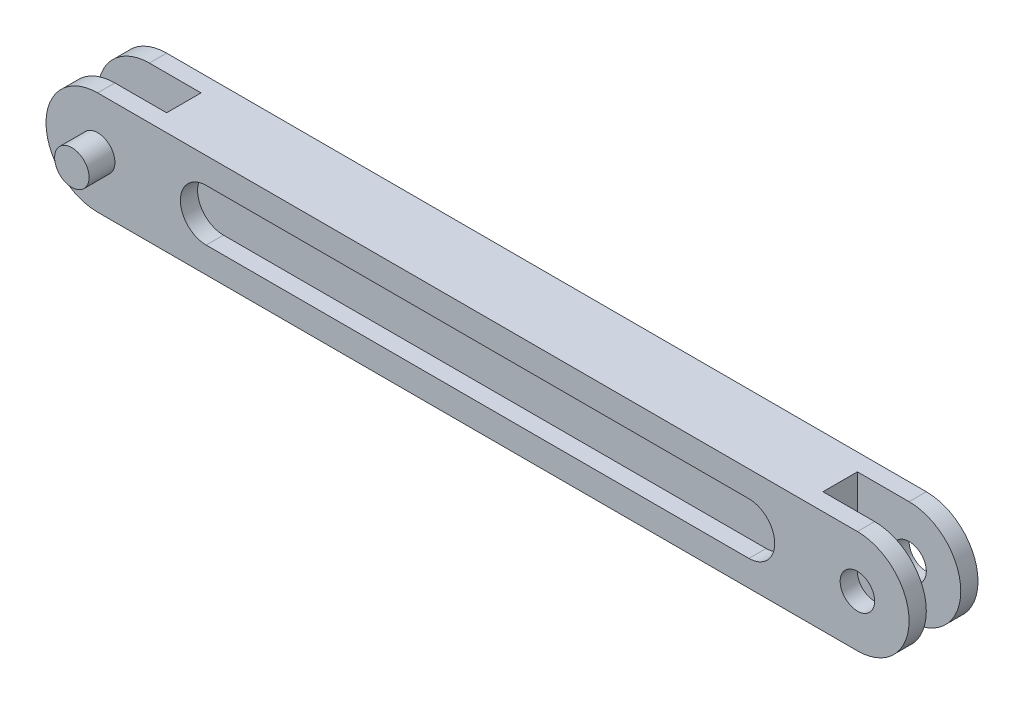
from build123d import *

# Parameters (mm, degrees)
SKETCH1_R                = 6.35
BOSS_EXTRUDE1_DEPTH      = 25.4
CUT_EXTRUDE1_DEPTH       = 6.35
SKETCH3_W                = 12.7
SKETCH3_H                = 38.1
CUT_EXTRUDE2_DEPTH       = 38.1
BOSS_EXTRUDE3_DEPTH      = 9.525
BOSS_EXTRUDE3_DEPTH_BACK = 34.925
SKETCH5_R                = 6.35


with BuildPart() as part:
    # Sketch1 → Boss-Extrude1 (new body)
    with BuildSketch(Plane.XY):
        with BuildLine():
            Line((0, 19.05), (280, 19.05))
            ThreePointArc((280, 19.05), (299.05, 0), (280, -19.05))
            Line((280, -19.05), (0, -19.05))
            ThreePointArc((0, -19.05), (-19.05, 0), (0, 19.05))
        make_face()
        Circle(SKETCH1_R, mode=Mode.SUBTRACT)
        with Locations((280, 0)):
            Circle(SKETCH1_R, mode=Mode.SUBTRACT)
    extrude(amount=BOSS_EXTRUDE1_DEPTH)

    # Sketch2 → Cut-Extrude1 (cut)
    with BuildSketch(Plane.XY.offset(25.4)):
        with BuildLine():
            Line((40, 9.525), (240, 9.525))
            ThreePointArc((240, 9.525), (249.525, 0), (240, -9.525))
            Line((240, -9.525), (40, -9.525))
            ThreePointArc((40, -9.525), (30.475, 0), (40, 9.525))
        make_face()
    cut_extrude1 = extrude(amount=-CUT_EXTRUDE1_DEPTH, mode=Mode.SUBTRACT)

    # Mirror1: Cut-Extrude1 across plane
    add(cut_extrude1.mirror(Plane.XY.offset(12.7)), mode=Mode.SUBTRACT)

    # Sketch3 → Cut-Extrude2 (cut)
    with BuildSketch(Plane.ZY.offset(19.05)):
        with Locations((12.7, 0)):
            Rectangle(SKETCH3_W, SKETCH3_H)
    cut_extrude2 = extrude(amount=-CUT_EXTRUDE2_DEPTH, mode=Mode.SUBTRACT)

    # Mirror2: Cut-Extrude2 across plane
    add(cut_extrude2.mirror(Plane.ZY.offset(-140)), mode=Mode.SUBTRACT)

    # Sketch5 → Boss-Extrude3 (add, two sides: drawn at the far end of the back side and taken through both)
    with BuildSketch(Plane.XY.offset(25.4).offset(-BOSS_EXTRUDE3_DEPTH_BACK)):
        Circle(SKETCH5_R)
    extrude(amount=BOSS_EXTRUDE3_DEPTH + BOSS_EXTRUDE3_DEPTH_BACK)


solid = part.part
